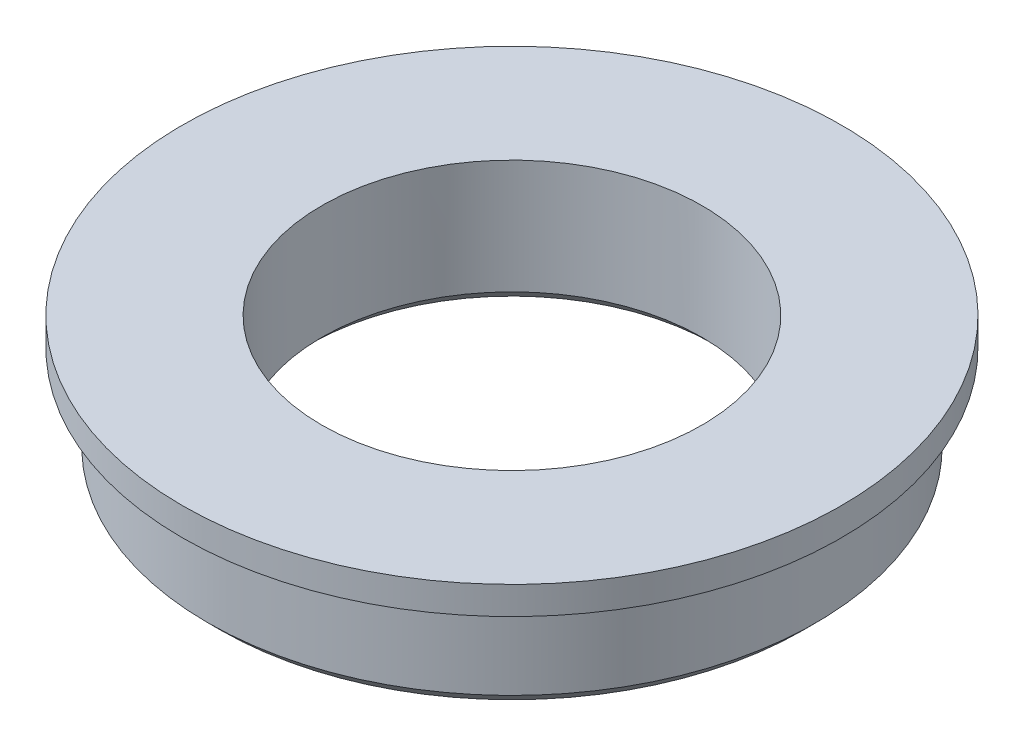
from build123d import *

# Parameters (mm, degrees)
CHAMFER_1_SIZE = 0.5


with BuildPart() as part:
    # 草图1 → 旋转1 (revolve)
    with BuildSketch(Plane.XY, mode=Mode.PRIVATE) as revolve_1_sk:
        Polygon((-7.5, 0), (-12, 0), (-12, 3.9), (-13, 3.9), (-13, 5), (-7.5, 5), align=None)
    revolve(revolve_1_sk.sketch.rotate(Axis((0, 22.088288084, 0), (0, -1, 0)), 270), axis=Axis((0, 22.088288084, 0), (0, -1, 0)))

    # 倒角1
    chamfer_1_edges = [part.edges().sort_by_distance(p)[0] for p in [
        (0, 0, -12),
        (0, 0, -7.5),
    ]]
    chamfer(chamfer_1_edges, length=CHAMFER_1_SIZE)


solid = part.part
